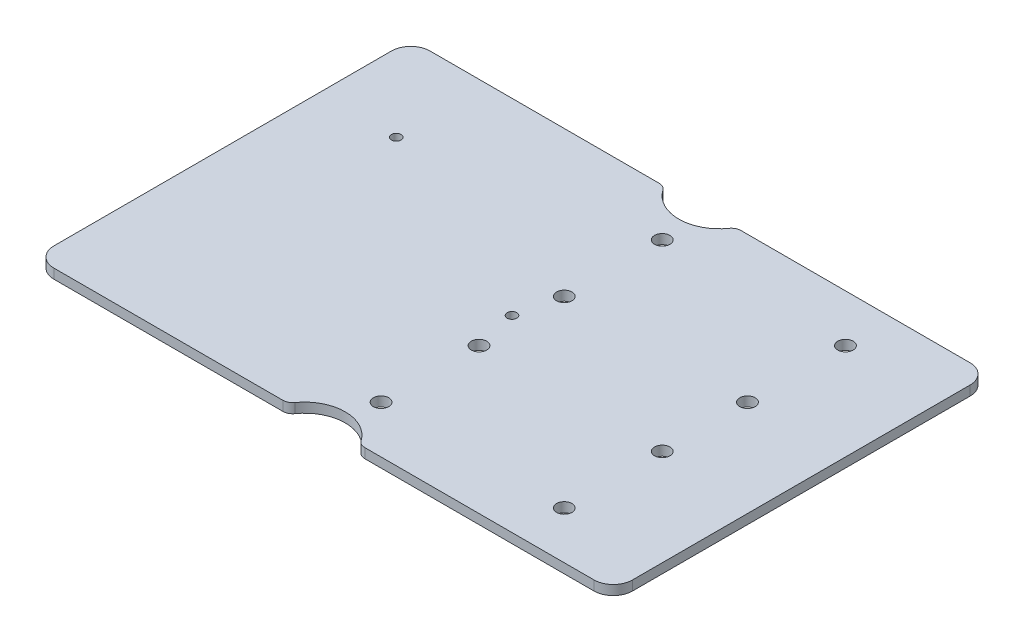
from build123d import *

# Parameters (mm, degrees)
SKETCH1_W                      = 40
SKETCH1_H                      = 39
BOSS_EXTRUDE1_DEPTH            = 1
SKETCH2_W                      = 20
SKETCH2_H                      = 39
BOSS_EXTRUDE2_DEPTH            = 1
FILLET1_R                      = 2
F_1_6_1_6_DIAMETER_HOLE1_D     = 1.6
F_1_6_1_6_DIAMETER_HOLE1_DEPTH = 19.77
F_1_6_1_6_DIAMETER_HOLE1_TIP   = 0.480688495
SKETCH11_R                     = 4.2
CUT_EXTRUDE1_DEPTH             = 7.4
FILLET2_R                      = 1
SKETCH12_R                     = 0.5
CUT_EXTRUDE2_DEPTH             = 10
SKETCH14_R                     = 0.5
CUT_EXTRUDE3_DEPTH             = 10


with BuildPart() as part:
    # Sketch1 → Boss-Extrude1 (new body)
    with BuildSketch(Plane(origin=(0, 0, 0), x_dir=(1, 0, 0), z_dir=(0, 1, 0))):
        Rectangle(SKETCH1_W, SKETCH1_H)
    extrude(amount=BOSS_EXTRUDE1_DEPTH)

    # Sketch2 → Boss-Extrude2 (add)
    with BuildSketch(Plane(origin=(0, 0, 0), x_dir=(1, 0, 0), z_dir=(0, 1, 0))):
        with Locations((-30, 0)):
            Rectangle(SKETCH2_W, SKETCH2_H)
    extrude(amount=BOSS_EXTRUDE2_DEPTH)

    # Fillet1
    fillet1_edges = [part.edges().sort_by_distance(p)[0] for p in [
        (-40, 0.5, -19.5),
        (-40, 0.5, 19.5),
        (20, 0.5, -19.5),
        (20, 0.5, 19.5),
    ]]
    fillet(fillet1_edges, radius=FILLET1_R)

    # Ø1.6 (1.6) Diameter Hole1
    with Locations(Plane(origin=(0, 1, 0), x_dir=(1, 0, 0), z_dir=(0, 1, 0))):
        with Locations((10, 14.58), (10, 4.42), (10, -4.42), (10, -14.58), (-9, -14.58), (-9, -4.42), (-9, 4.42), (-9, 14.58)):
            Hole(F_1_6_1_6_DIAMETER_HOLE1_D / 2, depth=F_1_6_1_6_DIAMETER_HOLE1_DEPTH)
            with Locations((0, 0, -(F_1_6_1_6_DIAMETER_HOLE1_DEPTH + F_1_6_1_6_DIAMETER_HOLE1_TIP / 2))):  # 118° drill point
                Cone(0, F_1_6_1_6_DIAMETER_HOLE1_D / 2, F_1_6_1_6_DIAMETER_HOLE1_TIP, mode=Mode.SUBTRACT)

    # Sketch11 → Cut-Extrude1 (cut)
    with BuildSketch(Plane(origin=(0, 0, 0), x_dir=(1, 0, 0), z_dir=(0, 1, 0))):
        with Locations((-10, -21.5)):
            Circle(SKETCH11_R)
        with Locations((-10, 21.5)):
            Circle(SKETCH11_R)
    extrude(amount=CUT_EXTRUDE1_DEPTH, mode=Mode.SUBTRACT)

    # Fillet2
    fillet2_edges = [part.edges().sort_by_distance(p)[0] for p in [
        (-6.306762937, 0.5, 19.5),
        (-13.693237063, 0.5, 19.5),
        (-13.693237063, 0.5, -19.5),
        (-6.306762937, 0.5, -19.5),
    ]]
    fillet(fillet2_edges, radius=FILLET2_R)

    # Sketch12 → Cut-Extrude2 (cut)
    with BuildSketch(Plane(origin=(0, 0, 0), x_dir=(1, 0, 0), z_dir=(0, 1, 0))):
        with Locations(Location((-32, 10, 0), (0, 0, 270))):
            Circle(SKETCH12_R)
    extrude(amount=CUT_EXTRUDE2_DEPTH, mode=Mode.SUBTRACT)

    # Sketch14 → Cut-Extrude3 (cut)
    with BuildSketch(Plane(origin=(0, 0, 0), x_dir=(1, 0, 0), z_dir=(0, 1, 0))):
        with Locations(Location((-10, 0, 0), (0, 0, 270))):
            Circle(SKETCH14_R)
    extrude(amount=CUT_EXTRUDE3_DEPTH, mode=Mode.SUBTRACT)


solid = part.part
